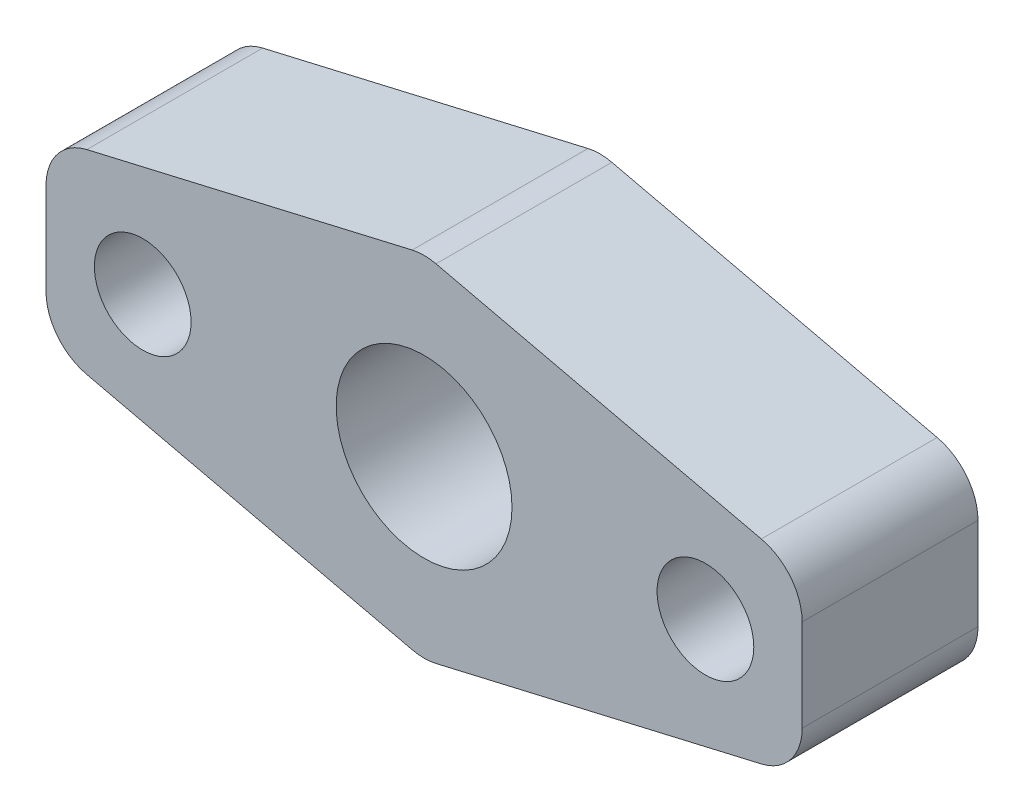
from build123d import *

# Parameters (mm, degrees)
SKETCH1_R           = 5
SKETCH1_R_2         = 2.75
BOSS_EXTRUDE1_DEPTH = 10
FILLET1_R           = 3


with BuildPart() as part:
    # Sketch1 → Boss-Extrude1 (new body)
    with BuildSketch(Plane.XY):
        Polygon((-21.5, -5), (-21.5, 5), (0, 10), (21.5, 5), (21.5, -5), (0, -10), align=None)
        Circle(SKETCH1_R, mode=Mode.SUBTRACT)
        with Locations((-16, 0)):
            Circle(SKETCH1_R_2, mode=Mode.SUBTRACT)
        with Locations((16, 0)):
            Circle(SKETCH1_R_2, mode=Mode.SUBTRACT)
    extrude(amount=BOSS_EXTRUDE1_DEPTH)

    # Fillet1
    fillet1_edges = [part.edges().sort_by_distance(p)[0] for p in [
        (21.5, 5, 5),
        (21.5, -5, 5),
        (0, -10, 5),
        (-21.5, -5, 5),
        (-21.5, 5, 5),
        (0, 10, 5),
    ]]
    fillet(fillet1_edges, radius=FILLET1_R)


solid = part.part
